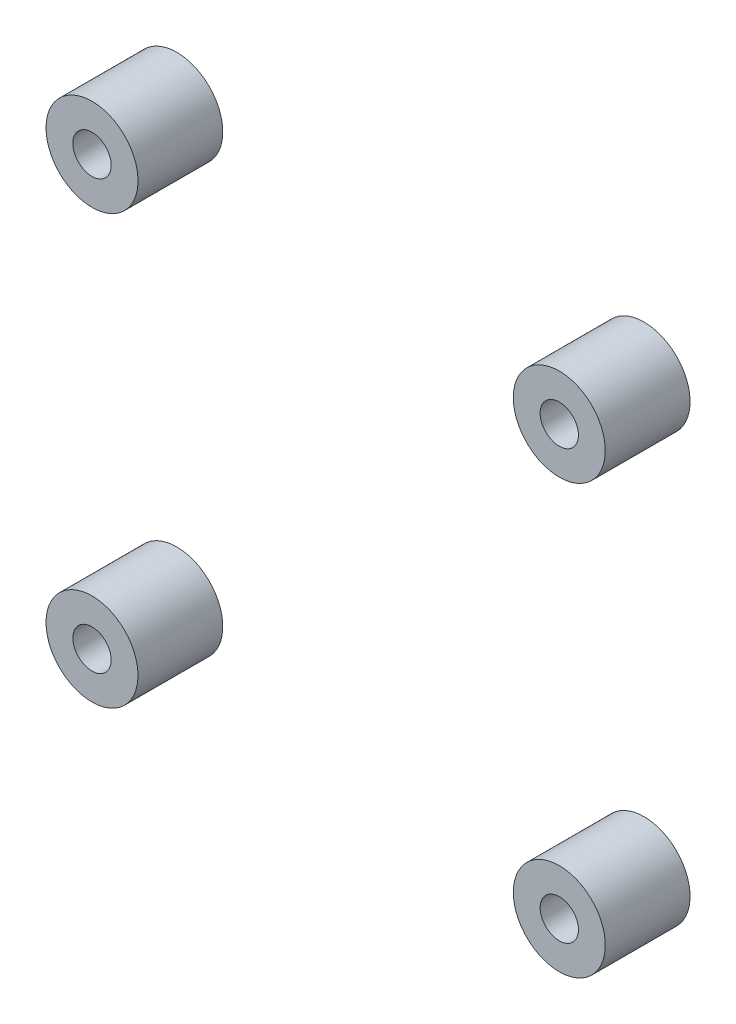
from build123d import *

# Parameters (mm, degrees)
SKETCH2_R             = 3
SKETCH2_R_2           = 1.25
BOSS_EXTRUDE2_DEPTH   = 5.53
BOSS_EXTRUDE2_2_DEPTH = 5.53
BOSS_EXTRUDE2_3_DEPTH = 5.53
BOSS_EXTRUDE2_4_DEPTH = 5.53


with BuildPart() as part:
    # Sketch2 → Boss-Extrude2 (new body)
    with BuildSketch(Plane.XY.offset(-8.179)):
        with Locations(Location((20.628484132, -11.898689855, 0), (0, 0, 180))):
            Circle(SKETCH2_R)
        with Locations(Location((20.628484132, -11.898689855, 0), (0, 0, 180))):
            Circle(SKETCH2_R_2, mode=Mode.SUBTRACT)
    extrude(amount=BOSS_EXTRUDE2_DEPTH)


with BuildPart() as body_2:
    # Sketch2 → Boss-Extrude2 2 (new body)
    with BuildSketch(Plane.XY.offset(-8.179)):
        with Locations(Location((-9.851515868, -11.898689855, 0), (0, 0, 180))):
            Circle(SKETCH2_R)
        with Locations(Location((-9.851515868, -11.898689855, 0), (0, 0, 180))):
            Circle(SKETCH2_R_2, mode=Mode.SUBTRACT)
    extrude(amount=BOSS_EXTRUDE2_2_DEPTH)


with BuildPart() as body_3:
    # Sketch2 → Boss-Extrude2 3 (new body)
    with BuildSketch(Plane.XY.offset(-8.179)):
        with Locations(Location((-9.851515868, 16.041310145, 0), (0, 0, 180))):
            Circle(SKETCH2_R)
        with Locations(Location((-9.851515868, 16.041310145, 0), (0, 0, 180))):
            Circle(SKETCH2_R_2, mode=Mode.SUBTRACT)
    extrude(amount=BOSS_EXTRUDE2_3_DEPTH)


with BuildPart() as body_4:
    # Sketch2 → Boss-Extrude2 4 (new body)
    with BuildSketch(Plane.XY.offset(-8.179)):
        with Locations(Location((20.628484132, 16.041310145, 0), (0, 0, 180))):
            Circle(SKETCH2_R)
        with Locations(Location((20.628484132, 16.041310145, 0), (0, 0, 180))):
            Circle(SKETCH2_R_2, mode=Mode.SUBTRACT)
    extrude(amount=BOSS_EXTRUDE2_4_DEPTH)


solid = Compound([part.part, body_2.part, body_3.part, body_4.part])
